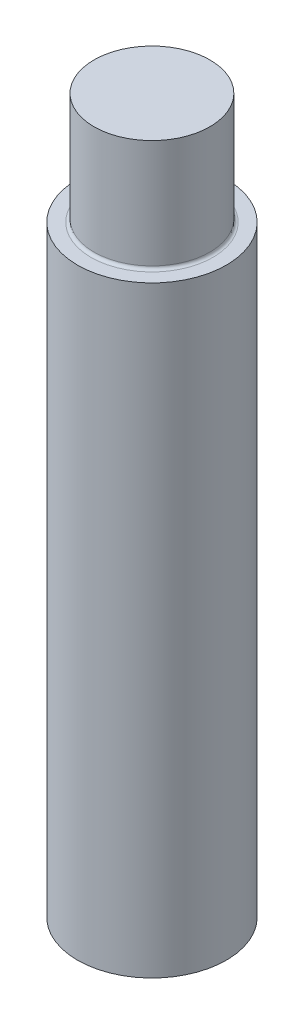
from build123d import *

# Parameters (mm, degrees)
CROQUIS2_R              = 12.2
SALIENTE_EXTRUIR1_DEPTH = 98.7
CROQUIS3_R              = 9.5
SALIENTE_EXTRUIR2_DEPTH = 18.3
REDONDEO2_R             = 0.5


with BuildPart() as part:
    # Croquis2 → Saliente-Extruir1 (new body)
    with BuildSketch(Plane(origin=(0, 0, 0), x_dir=(1, 0, 0), z_dir=(0, 1, 0))):
        with Locations(Location((0, 0, 0), (0, 0, 270))):
            Circle(CROQUIS2_R)
    extrude(amount=SALIENTE_EXTRUIR1_DEPTH)

    # Croquis3 → Saliente-Extruir2 (add)
    with BuildSketch(Plane(origin=(0, 98.7, 0), x_dir=(1, 0, 0), z_dir=(0, 1, 0))):
        with Locations(Location((0, 0, 0), (0, 0, 270))):
            Circle(CROQUIS3_R)
    extrude(amount=SALIENTE_EXTRUIR2_DEPTH)

    # Redondeo2
    redondeo2_edges = [part.edges().sort_by_distance(p)[0] for p in [
        (0, 98.7, -9.5),
    ]]
    fillet(redondeo2_edges, radius=REDONDEO2_R)


solid = part.part
